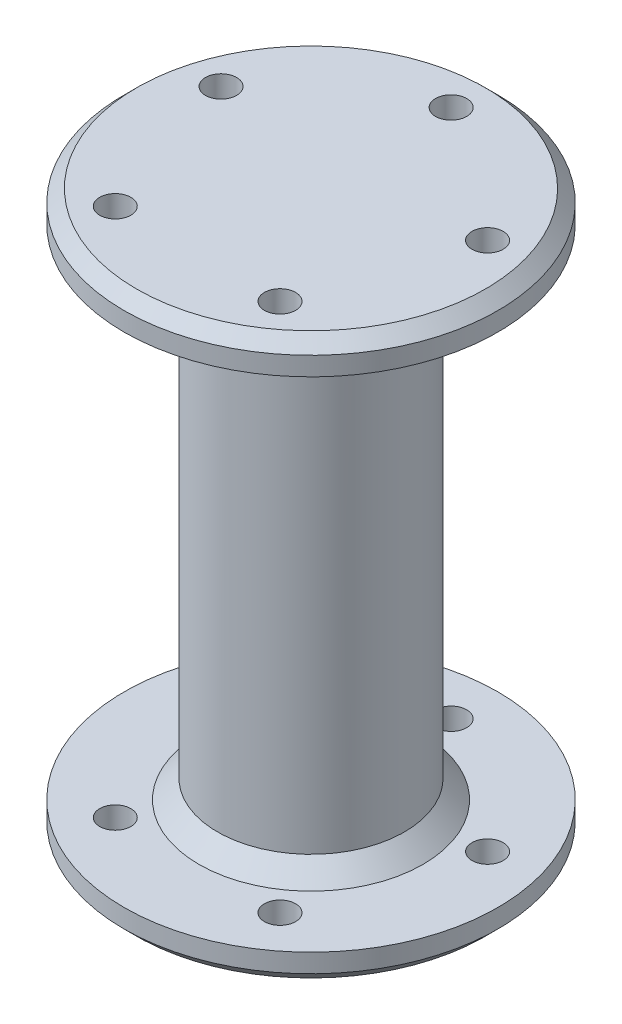
from build123d import *

# Parameters (mm, degrees)
SKETCH1_R                = 15
BOSS_EXTRUDE1_DEPTH      = 40
SKETCH4_R                = 30
BOSS_EXTRUDE2_DEPTH      = 5
CHAMFER1_SIZE            = 2
SKETCH6_R                = 2.5
CUT_EXTRUDE1_DEPTH       = 96
CIRPATTERN1_COUNT        = 5
CHAMFER2_SIZE            = 3
MIRROR1_COPY_1_SKETCH_R  = 2.5
MIRROR1_COPY_1_DEPTH     = 96
MIRROR1_COPY_2_SKETCH_R  = 2.5
MIRROR1_COPY_2_DEPTH     = 96
MIRROR1_COPY_3_SKETCH_R  = 2.5
MIRROR1_COPY_3_DEPTH     = 96
MIRROR1_COPY_4_SKETCH_R  = 2.5
MIRROR1_COPY_4_DEPTH     = 96
MIRROR1_COPY_5_SKETCH_R  = 2.5
MIRROR1_COPY_5_DEPTH     = 96
CHAMFER1_OF_MIRROR1_SIZE = 2
CHAMFER2_OF_MIRROR1_SIZE = 3


with BuildPart() as part:
    # Sketch1 → Boss-Extrude1 (new, symmetric)
    with BuildSketch(Plane(origin=(0, 0, 0), x_dir=(1, 0, 0), z_dir=(0, 1, 0))):
        with Locations(Location((0, 0, 0), (0, 0, 270))):
            Circle(SKETCH1_R)
    extrude(amount=BOSS_EXTRUDE1_DEPTH, both=True)

    # Sketch4 → Boss-Extrude2 (add)
    with BuildSketch(Plane(origin=(0, 40, 0), x_dir=(1, 0, 0), z_dir=(0, 1, 0))):
        with Locations(Location((0, 0, 0), (0, 0, 270))):
            Circle(SKETCH4_R)
    boss_extrude2 = extrude(amount=BOSS_EXTRUDE2_DEPTH)

    # Chamfer1
    chamfer1_edges = [part.edges().sort_by_distance(p)[0] for p in [
        (0, 45, -30),
    ]]
    chamfer(chamfer1_edges, length=CHAMFER1_SIZE)

    # Sketch6 → Cut-Extrude1 (cut, through all)
    with BuildSketch(Plane(origin=(0, 45, 0), x_dir=(1, 0, 0), z_dir=(0, 1, 0))):
        with Locations(Location((0, 22.5, 0), (0, 0, 270))):
            Circle(SKETCH6_R)
    cut_extrude1 = extrude(amount=-CUT_EXTRUDE1_DEPTH, mode=Mode.SUBTRACT)

    # CirPattern1: Cut-Extrude1 ×5 about axis
    cirpattern1_axis = Axis((0, 0, 0), (0, 1, 0))
    for i in range(1, CIRPATTERN1_COUNT):
        add(cut_extrude1.rotate(cirpattern1_axis, i * 360 / CIRPATTERN1_COUNT), mode=Mode.SUBTRACT)

    # Chamfer2
    chamfer2_edges = [part.edges().sort_by_distance(p)[0] for p in [
        (0, 40, -15),
    ]]
    chamfer(chamfer2_edges, length=CHAMFER2_SIZE)

    # Mirror1: Boss-Extrude2 across plane
    add(boss_extrude2.mirror(Plane.ZX))

    # Mirror1 copy 1 sketch → Mirror1 copy 1 (cut, through all)
    with BuildSketch(Plane(origin=(0, -45, 0), x_dir=(0.30901699437494745, 0, -0.9510565162951535), z_dir=(0, -1, 0))):
        with Locations((0, -22.5)):
            Circle(MIRROR1_COPY_1_SKETCH_R)
    extrude(amount=-MIRROR1_COPY_1_DEPTH, mode=Mode.SUBTRACT)

    # Mirror1 copy 2 sketch → Mirror1 copy 2 (cut, through all)
    with BuildSketch(Plane(origin=(0, -45, 0), x_dir=(-0.8090169943749473, 0, -0.5877852522924732), z_dir=(0, -1, 0))):
        with Locations((0, -22.5)):
            Circle(MIRROR1_COPY_2_SKETCH_R)
    extrude(amount=-MIRROR1_COPY_2_DEPTH, mode=Mode.SUBTRACT)

    # Mirror1 copy 3 sketch → Mirror1 copy 3 (cut, through all)
    with BuildSketch(Plane(origin=(0, -45, 0), x_dir=(-0.8090169943749476, 0, 0.587785252292473), z_dir=(0, -1, 0))):
        with Locations((0, -22.5)):
            Circle(MIRROR1_COPY_3_SKETCH_R)
    extrude(amount=-MIRROR1_COPY_3_DEPTH, mode=Mode.SUBTRACT)

    # Mirror1 copy 4 sketch → Mirror1 copy 4 (cut, through all)
    with BuildSketch(Plane(origin=(0, -45, 0), x_dir=(0.30901699437494723, 0, 0.9510565162951536), z_dir=(0, -1, 0))):
        with Locations((0, -22.5)):
            Circle(MIRROR1_COPY_4_SKETCH_R)
    extrude(amount=-MIRROR1_COPY_4_DEPTH, mode=Mode.SUBTRACT)

    # Mirror1 copy 5 sketch → Mirror1 copy 5 (cut, through all)
    with BuildSketch(Plane.XZ.offset(45)):
        with Locations((0, -22.5)):
            Circle(MIRROR1_COPY_5_SKETCH_R)
    extrude(amount=-MIRROR1_COPY_5_DEPTH, mode=Mode.SUBTRACT)

    # Chamfer1 of Mirror1
    chamfer1_of_mirror1_edges = [part.edges().sort_by_distance(p)[0] for p in [
        (0, -45, -30),
    ]]
    chamfer(chamfer1_of_mirror1_edges, length=CHAMFER1_OF_MIRROR1_SIZE)

    # Chamfer2 of Mirror1
    chamfer2_of_mirror1_edges = [part.edges().sort_by_distance(p)[0] for p in [
        (0, -40, -15),
    ]]
    chamfer(chamfer2_of_mirror1_edges, length=CHAMFER2_OF_MIRROR1_SIZE)


solid = part.part
